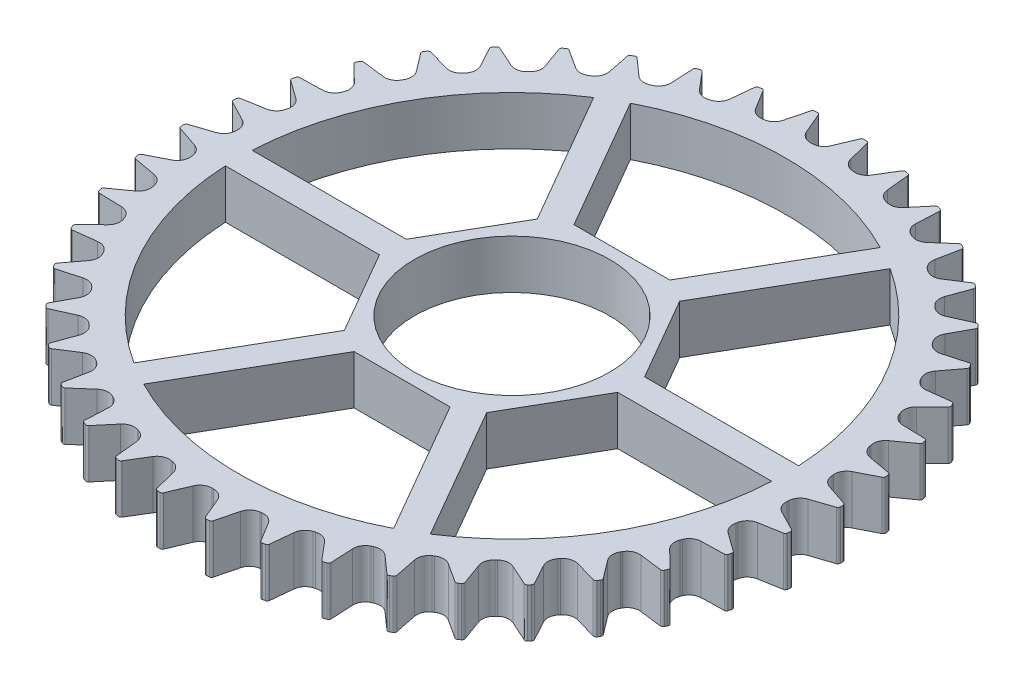
from build123d import *

# Parameters (mm, degrees)
SKETCH_1_R      = 4
EXTRUDE_1_DEPTH = 2


with BuildPart() as part:
    # 草图1 → 凸台-拉伸1 (new body)
    with BuildSketch(Plane(origin=(0, 0, 0), x_dir=(1, 0, 0), z_dir=(0, 1, 0))):
        with BuildLine():
            Line((12.557441002, 0.442284614), (13.431815796, 0.147771369))
            ThreePointArc((13.431815796, 0.147771369), (13.480995582, 0.111506892), (13.499894393, 0.053398385))
            ThreePointArc((13.499894393, 0.053398385), (13.5, 0), (13.499894393, -0.053398385))
            ThreePointArc((13.499894393, -0.053398385), (13.480995582, -0.111506892), (13.431815796, -0.147771369))
            Line((13.431815796, -0.147771369), (12.557441002, -0.442284614))
            ThreePointArc((12.557441002, -0.442284614), (12.321714026, -0.609999625), (12.218336496, -0.880200696))
            ThreePointArc((12.218336496, -0.880200696), (12.215746515, -0.915443646), (12.213054879, -0.950678979))
            ThreePointArc((12.213054879, -0.950678979), (12.275006387, -1.233269748), (12.483103862, -1.434244804))
            Line((12.483103862, -1.434244804), (13.303817691, -1.85578738))
            ThreePointArc((13.303817691, -1.85578738), (13.34704324, -1.89897668), (13.357070343, -1.959252884))
            ThreePointArc((13.357070343, -1.959252884), (13.349216154, -2.012070593), (13.34115311, -2.064856822))
            ThreePointArc((13.34115311, -2.064856822), (13.31380476, -2.119499584), (13.259769332, -2.148029151))
            Line((13.259769332, -2.148029151), (12.35126566, -2.308934125))
            ThreePointArc((12.35126566, -2.308934125), (12.093174934, -2.439642615), (11.950680666, -2.691418142))
            ThreePointArc((11.950680666, -2.691418142), (11.942866924, -2.725881441), (11.934953797, -2.760322056))
            ThreePointArc((11.934953797, -2.760322056), (11.954095389, -3.048989913), (12.12991481, -3.278735563))
            Line((12.12991481, -3.278735563), (12.878634283, -3.817890906))
            ThreePointArc((12.878634283, -3.817890906), (12.914940007, -3.86704025), (12.915871413, -3.928137682))
            ThreePointArc((12.915871413, -3.928137682), (12.900232878, -3.979194855), (12.884392512, -4.030189771))
            ThreePointArc((12.884392512, -4.030189771), (12.84920554, -4.080146158), (12.791521531, -4.10030351))
            Line((12.791521531, -4.10030351), (11.869183453, -4.124005862))
            ThreePointArc((11.869183453, -4.124005862), (11.594494298, -4.21478802), (11.416066378, -4.442513754))
            ThreePointArc((11.416066378, -4.442513754), (11.403203421, -4.475427548), (11.39024557, -4.5083041))
            ThreePointArc((11.39024557, -4.5083041), (11.366149655, -4.796600682), (11.505763505, -5.049984787))
            Line((11.505763505, -5.049984787), (12.165763466, -5.694709057))
            ThreePointArc((12.165763466, -5.694709057), (12.194338355, -5.748720532), (12.186153259, -5.809274374))
            ThreePointArc((12.186153259, -5.809274374), (12.163079717, -5.857430478), (12.139815877, -5.905494939))
            ThreePointArc((12.139815877, -5.905494939), (12.0975763, -5.949649009), (12.037532278, -5.960983864))
            Line((12.037532278, -5.960983864), (11.121963301, -5.846954124))
            ThreePointArc((11.121963301, -5.846954124), (10.836811818, -5.895782026), (10.626436031, -6.094370949))
            ThreePointArc((10.626436031, -6.094370949), (10.608811196, -6.125), (10.591098078, -6.15557808))
            ThreePointArc((10.591098078, -6.15557808), (10.524302918, -6.437063318), (10.624592456, -6.708425697))
            Line((10.624592456, -6.708425697), (11.181129597, -7.444316819))
            ThreePointArc((11.181129597, -7.444316819), (11.201335335, -7.501983896), (11.184216578, -7.560641477))
            ThreePointArc((11.184216578, -7.560641477), (11.154223453, -7.604820784), (11.124055815, -7.648881109))
            ThreePointArc((11.124055815, -7.648881109), (11.075707197, -7.686246532), (11.014644444, -7.688505689))
            Line((11.014644444, -7.688505689), (10.126296867, -7.439291092))
            ThreePointArc((10.126296867, -7.439291092), (9.83705287, -7.445074003), (9.599428664, -7.610089969))
            ThreePointArc((9.599428664, -7.610089969), (9.57743566, -7.637750073), (9.555362956, -7.665346618))
            ThreePointArc((9.555362956, -7.665346618), (9.447360646, -7.933732596), (9.506085569, -8.217011461))
            Line((9.506085569, -8.217011461), (9.946727768, -9.027630844))
            ThreePointArc((9.946727768, -9.027630844), (9.958112994, -9.087665337), (9.93244298, -9.143116343))
            ThreePointArc((9.93244298, -9.143116343), (9.89620027, -9.18233196), (9.859802728, -9.221403915))
            ThreePointArc((9.859802728, -9.221403915), (9.806425097, -9.251146009), (9.745707655, -9.244279002))
            Line((9.745707655, -9.244279002), (8.904425695, -8.86544659))
            ThreePointArc((8.904425695, -8.86544659), (8.617550415, -8.82805533), (8.357985922, -8.955812153))
            ThreePointArc((8.357985922, -8.955812153), (8.332116038, -8.97988543), (8.306176816, -9.003883979))
            ThreePointArc((8.306176816, -9.003883979), (8.159379948, -9.253175398), (8.175228438, -9.542042768))
            Line((8.175228438, -9.542042768), (8.490132478, -10.409282514))
            ThreePointArc((8.490132478, -10.409282514), (8.492442863, -10.470343351), (8.458795018, -10.521349098))
            ThreePointArc((8.458795018, -10.521349098), (8.417112325, -10.554725013), (8.375297942, -10.587935795))
            ThreePointArc((8.375297942, -10.587935795), (8.318083666, -10.609390171), (8.259067861, -10.593550398))
            Line((8.259067861, -10.593550398), (7.483644366, -10.093562661))
            ThreePointArc((7.483644366, -10.093562661), (7.205546125, -10.013832489), (6.929839586, -10.101476294))
            ThreePointArc((6.929839586, -10.101476294), (6.900670711, -10.121424985), (6.871444411, -10.14128945))
            ThreePointArc((6.871444411, -10.14128945), (6.689132185, -10.365917552), (6.661750212, -10.653920607))
            Line((6.661750212, -10.653920607), (6.843881658, -11.558408014))
            ThreePointArc((6.843881658, -11.558408014), (6.837065592, -11.619131196), (6.796191554, -11.6645523))
            ThreePointArc((6.796191554, -11.6645523), (6.75, -11.691342951), (6.703702838, -11.717950685))
            ThreePointArc((6.703702838, -11.717950685), (6.64392999, -11.730638088), (6.587934138, -11.706179383))
            Line((6.587934138, -11.706179383), (5.895690789, -11.096205221))
            ThreePointArc((5.895690789, -11.096205221), (5.632581841, -10.975917177), (5.346892085, -11.021490146))
            ThreePointArc((5.346892085, -11.021490146), (5.315075804, -11.036868632), (5.283215293, -11.052155272))
            ThreePointArc((5.283215293, -11.052155272), (5.069460262, -11.247102237), (4.999459496, -11.527807465))
            Line((4.999459496, -11.527807465), (5.044749831, -12.449337778))
            ThreePointArc((5.044749831, -12.449337778), (5.028959574, -12.508366851), (4.981772401, -12.547188679))
            ThreePointArc((4.981772401, -12.547188679), (4.932103829, -12.566795607), (4.882358092, -12.58620592))
            ThreePointArc((4.882358092, -12.58620592), (4.821361897, -12.589842935), (4.769636853, -12.557311665))
            Line((4.769636853, -12.557311665), (4.176037222, -11.850976893))
            ThreePointArc((4.176037222, -11.850976893), (3.933794986, -11.692818013), (3.64450385, -11.69530212))
            ThreePointArc((3.64450385, -11.69530212), (3.610750887, -11.705766871), (3.576967875, -11.71613421))
            ThreePointArc((3.576967875, -11.71613421), (3.336544974, -11.877045243), (3.225489115, -12.144182153))
            Line((3.225489115, -12.144182153), (3.132926628, -13.062169908))
            ThreePointArc((3.132926628, -13.062169908), (3.108514909, -13.118186259), (3.056068684, -13.149541596))
            ThreePointArc((3.056068684, -13.149541596), (3.004032608, -13.161526814), (2.951949533, -13.173306113))
            ThreePointArc((2.951949533, -13.173306113), (2.891092546, -13.167811495), (2.844793763, -13.127934354))
            Line((2.844793763, -13.127934354), (2.363097884, -12.341017323))
            ThreePointArc((2.363097884, -12.341017323), (2.147133652, -12.148520616), (1.860703422, -12.107860372))
            ThreePointArc((1.860703422, -12.107860372), (1.825767761, -12.113177621), (1.790816906, -12.118394069))
            ThreePointArc((1.790816906, -12.118394069), (1.529096785, -12.241674685), (1.379466638, -12.489275879))
            Line((1.379466638, -12.489275879), (1.151119022, -13.383214747))
            ThreePointArc((1.151119022, -13.383214747), (1.118631158, -13.434967064), (1.062097444, -13.458155484))
            ThreePointArc((1.062097444, -13.458155484), (1.008856263, -13.462251262), (0.955599299, -13.466136416))
            ThreePointArc((0.955599299, -13.466136416), (0.896240965, -13.451632905), (0.856402681, -13.405300683))
            Line((0.856402681, -13.405300683), (0.497370845, -12.55537982))
            ThreePointArc((0.497370845, -12.55537982), (0.3125089, -12.332845343), (0.035337953, -12.24994903))
            ThreePointArc((0.035337953, -12.24994903), (0, -12.25), (-0.035337953, -12.24994903))
            ThreePointArc((-0.035337953, -12.24994903), (-0.3125089, -12.332845343), (-0.497370845, -12.55537982))
            Line((-0.497370845, -12.55537982), (-0.856402681, -13.405300683))
            ThreePointArc((-0.856402681, -13.405300683), (-0.896240965, -13.451632905), (-0.955599299, -13.466136416))
            ThreePointArc((-0.955599299, -13.466136416), (-1.008856263, -13.462251262), (-1.062097444, -13.458155484))
            ThreePointArc((-1.062097444, -13.458155484), (-1.118631158, -13.434967064), (-1.151119022, -13.383214747))
            Line((-1.151119022, -13.383214747), (-1.379466638, -12.489275879))
            ThreePointArc((-1.379466638, -12.489275879), (-1.529096785, -12.241674685), (-1.790816906, -12.118394069))
            ThreePointArc((-1.790816906, -12.118394069), (-1.825767761, -12.113177621), (-1.860703422, -12.107860372))
            ThreePointArc((-1.860703422, -12.107860372), (-2.147133652, -12.148520616), (-2.363097884, -12.341017323))
            Line((-2.363097884, -12.341017323), (-2.844793763, -13.127934354))
            ThreePointArc((-2.844793763, -13.127934354), (-2.891092546, -13.167811495), (-2.951949533, -13.173306113))
            ThreePointArc((-2.951949533, -13.173306113), (-3.004032608, -13.161526814), (-3.056068684, -13.149541596))
            ThreePointArc((-3.056068684, -13.149541596), (-3.108514909, -13.118186259), (-3.132926628, -13.062169908))
            Line((-3.132926628, -13.062169908), (-3.225489115, -12.144182153))
            ThreePointArc((-3.225489115, -12.144182153), (-3.336544974, -11.877045243), (-3.576967875, -11.71613421))
            ThreePointArc((-3.576967875, -11.71613421), (-3.610750887, -11.705766871), (-3.64450385, -11.69530212))
            ThreePointArc((-3.64450385, -11.69530212), (-3.933794986, -11.692818013), (-4.176037222, -11.850976893))
            Line((-4.176037222, -11.850976893), (-4.769636853, -12.557311665))
            ThreePointArc((-4.769636853, -12.557311665), (-4.821361897, -12.589842935), (-4.882358092, -12.58620592))
            ThreePointArc((-4.882358092, -12.58620592), (-4.932103829, -12.566795607), (-4.981772401, -12.547188679))
            ThreePointArc((-4.981772401, -12.547188679), (-5.028959574, -12.508366851), (-5.044749831, -12.449337778))
            Line((-5.044749831, -12.449337778), (-4.999459496, -11.527807465))
            ThreePointArc((-4.999459496, -11.527807465), (-5.069460262, -11.247102237), (-5.283215293, -11.052155272))
            ThreePointArc((-5.283215293, -11.052155272), (-5.315075804, -11.036868632), (-5.346892085, -11.021490146))
            ThreePointArc((-5.346892085, -11.021490146), (-5.632581841, -10.975917177), (-5.895690789, -11.096205221))
            Line((-5.895690789, -11.096205221), (-6.587934138, -11.706179383))
            ThreePointArc((-6.587934138, -11.706179383), (-6.64392999, -11.730638088), (-6.703702838, -11.717950685))
            ThreePointArc((-6.703702838, -11.717950685), (-6.75, -11.691342951), (-6.796191554, -11.6645523))
            ThreePointArc((-6.796191554, -11.6645523), (-6.837065592, -11.619131196), (-6.843881658, -11.558408014))
            Line((-6.843881658, -11.558408014), (-6.661750212, -10.653920607))
            ThreePointArc((-6.661750212, -10.653920607), (-6.689132185, -10.365917552), (-6.871444411, -10.14128945))
            ThreePointArc((-6.871444411, -10.14128945), (-6.900670711, -10.121424985), (-6.929839586, -10.101476294))
            ThreePointArc((-6.929839586, -10.101476294), (-7.205546125, -10.013832489), (-7.483644366, -10.093562661))
            Line((-7.483644366, -10.093562661), (-8.259067861, -10.593550398))
            ThreePointArc((-8.259067861, -10.593550398), (-8.318083666, -10.609390171), (-8.375297942, -10.587935795))
            ThreePointArc((-8.375297942, -10.587935795), (-8.417112325, -10.554725013), (-8.458795018, -10.521349098))
            ThreePointArc((-8.458795018, -10.521349098), (-8.492442863, -10.470343351), (-8.490132478, -10.409282514))
            Line((-8.490132478, -10.409282514), (-8.175228438, -9.542042768))
            ThreePointArc((-8.175228438, -9.542042768), (-8.159379948, -9.253175398), (-8.306176816, -9.003883979))
            ThreePointArc((-8.306176816, -9.003883979), (-8.332116038, -8.97988543), (-8.357985922, -8.955812153))
            ThreePointArc((-8.357985922, -8.955812153), (-8.617550415, -8.82805533), (-8.904425695, -8.86544659))
            Line((-8.904425695, -8.86544659), (-9.745707655, -9.244279002))
            ThreePointArc((-9.745707655, -9.244279002), (-9.806425097, -9.251146009), (-9.859802728, -9.221403915))
            ThreePointArc((-9.859802728, -9.221403915), (-9.89620027, -9.18233196), (-9.93244298, -9.143116343))
            ThreePointArc((-9.93244298, -9.143116343), (-9.958112994, -9.087665337), (-9.946727768, -9.027630844))
            Line((-9.946727768, -9.027630844), (-9.506085569, -8.217011461))
            ThreePointArc((-9.506085569, -8.217011461), (-9.447360646, -7.933732596), (-9.555362956, -7.665346618))
            ThreePointArc((-9.555362956, -7.665346618), (-9.57743566, -7.637750073), (-9.599428664, -7.610089969))
            ThreePointArc((-9.599428664, -7.610089969), (-9.83705287, -7.445074003), (-10.126296867, -7.439291092))
            Line((-10.126296867, -7.439291092), (-11.014644444, -7.688505689))
            ThreePointArc((-11.014644444, -7.688505689), (-11.075707197, -7.686246532), (-11.124055815, -7.648881109))
            ThreePointArc((-11.124055815, -7.648881109), (-11.154223453, -7.604820784), (-11.184216578, -7.560641477))
            ThreePointArc((-11.184216578, -7.560641477), (-11.201335335, -7.501983896), (-11.181129597, -7.444316819))
            Line((-11.181129597, -7.444316819), (-10.624592456, -6.708425697))
            ThreePointArc((-10.624592456, -6.708425697), (-10.524302918, -6.437063318), (-10.591098078, -6.15557808))
            ThreePointArc((-10.591098078, -6.15557808), (-10.608811196, -6.125), (-10.626436031, -6.094370949))
            ThreePointArc((-10.626436031, -6.094370949), (-10.836811818, -5.895782026), (-11.121963301, -5.846954124))
            Line((-11.121963301, -5.846954124), (-12.037532278, -5.960983864))
            ThreePointArc((-12.037532278, -5.960983864), (-12.0975763, -5.949649009), (-12.139815877, -5.905494939))
            ThreePointArc((-12.139815877, -5.905494939), (-12.163079717, -5.857430478), (-12.186153259, -5.809274374))
            ThreePointArc((-12.186153259, -5.809274374), (-12.194338355, -5.748720532), (-12.165763466, -5.694709057))
            Line((-12.165763466, -5.694709057), (-11.505763505, -5.049984787))
            ThreePointArc((-11.505763505, -5.049984787), (-11.366149655, -4.796600682), (-11.39024557, -4.5083041))
            ThreePointArc((-11.39024557, -4.5083041), (-11.403203421, -4.475427548), (-11.416066378, -4.442513754))
            ThreePointArc((-11.416066378, -4.442513754), (-11.594494298, -4.21478802), (-11.869183453, -4.124005862))
            Line((-11.869183453, -4.124005862), (-12.791521531, -4.10030351))
            ThreePointArc((-12.791521531, -4.10030351), (-12.84920554, -4.080146158), (-12.884392512, -4.030189771))
            ThreePointArc((-12.884392512, -4.030189771), (-12.900232878, -3.979194855), (-12.915871413, -3.928137682))
            ThreePointArc((-12.915871413, -3.928137682), (-12.914940007, -3.86704025), (-12.878634283, -3.817890906))
            Line((-12.878634283, -3.817890906), (-12.12991481, -3.278735563))
            ThreePointArc((-12.12991481, -3.278735563), (-11.954095389, -3.048989913), (-11.934953797, -2.760322056))
            ThreePointArc((-11.934953797, -2.760322056), (-11.942866924, -2.725881441), (-11.950680666, -2.691418142))
            ThreePointArc((-11.950680666, -2.691418142), (-12.093174934, -2.439642615), (-12.35126566, -2.308934125))
            Line((-12.35126566, -2.308934125), (-13.259769332, -2.148029151))
            ThreePointArc((-13.259769332, -2.148029151), (-13.31380476, -2.119499584), (-13.34115311, -2.064856822))
            ThreePointArc((-13.34115311, -2.064856822), (-13.349216154, -2.012070593), (-13.357070343, -1.959252884))
            ThreePointArc((-13.357070343, -1.959252884), (-13.34704324, -1.89897668), (-13.303817691, -1.85578738))
            Line((-13.303817691, -1.85578738), (-12.483103862, -1.434244804))
            ThreePointArc((-12.483103862, -1.434244804), (-12.275006387, -1.233269748), (-12.213054879, -0.950678979))
            ThreePointArc((-12.213054879, -0.950678979), (-12.215746515, -0.915443646), (-12.218336496, -0.880200696))
            ThreePointArc((-12.218336496, -0.880200696), (-12.321714026, -0.609999625), (-12.557441002, -0.442284614))
            Line((-12.557441002, -0.442284614), (-13.431815796, -0.147771369))
            ThreePointArc((-13.431815796, -0.147771369), (-13.480995582, -0.111506892), (-13.499894393, -0.053398385))
            ThreePointArc((-13.499894393, -0.053398385), (-13.5, 0), (-13.499894393, 0.053398385))
            ThreePointArc((-13.499894393, 0.053398385), (-13.480995582, 0.111506892), (-13.431815796, 0.147771369))
            Line((-13.431815796, 0.147771369), (-12.557441002, 0.442284614))
            ThreePointArc((-12.557441002, 0.442284614), (-12.321714026, 0.609999625), (-12.218336496, 0.880200696))
            ThreePointArc((-12.218336496, 0.880200696), (-12.215746515, 0.915443646), (-12.213054879, 0.950678979))
            ThreePointArc((-12.213054879, 0.950678979), (-12.275006387, 1.233269748), (-12.483103862, 1.434244804))
            Line((-12.483103862, 1.434244804), (-13.303817691, 1.85578738))
            ThreePointArc((-13.303817691, 1.85578738), (-13.34704324, 1.89897668), (-13.357070343, 1.959252884))
            ThreePointArc((-13.357070343, 1.959252884), (-13.349216154, 2.012070593), (-13.34115311, 2.064856822))
            ThreePointArc((-13.34115311, 2.064856822), (-13.31380476, 2.119499584), (-13.259769332, 2.148029151))
            Line((-13.259769332, 2.148029151), (-12.35126566, 2.308934125))
            ThreePointArc((-12.35126566, 2.308934125), (-12.093174934, 2.439642615), (-11.950680666, 2.691418142))
            ThreePointArc((-11.950680666, 2.691418142), (-11.942866924, 2.725881441), (-11.934953797, 2.760322056))
            ThreePointArc((-11.934953797, 2.760322056), (-11.954095389, 3.048989913), (-12.12991481, 3.278735563))
            Line((-12.12991481, 3.278735563), (-12.878634283, 3.817890906))
            ThreePointArc((-12.878634283, 3.817890906), (-12.914940007, 3.86704025), (-12.915871413, 3.928137682))
            ThreePointArc((-12.915871413, 3.928137682), (-12.900232878, 3.979194855), (-12.884392512, 4.030189771))
            ThreePointArc((-12.884392512, 4.030189771), (-12.84920554, 4.080146158), (-12.791521531, 4.10030351))
            Line((-12.791521531, 4.10030351), (-11.869183453, 4.124005862))
            ThreePointArc((-11.869183453, 4.124005862), (-11.594494298, 4.21478802), (-11.416066378, 4.442513754))
            ThreePointArc((-11.416066378, 4.442513754), (-11.403203421, 4.475427548), (-11.39024557, 4.5083041))
            ThreePointArc((-11.39024557, 4.5083041), (-11.366149655, 4.796600682), (-11.505763505, 5.049984787))
            Line((-11.505763505, 5.049984787), (-12.165763466, 5.694709057))
            ThreePointArc((-12.165763466, 5.694709057), (-12.194338355, 5.748720532), (-12.186153259, 5.809274374))
            ThreePointArc((-12.186153259, 5.809274374), (-12.163079717, 5.857430478), (-12.139815877, 5.905494939))
            ThreePointArc((-12.139815877, 5.905494939), (-12.0975763, 5.949649009), (-12.037532278, 5.960983864))
            Line((-12.037532278, 5.960983864), (-11.121963301, 5.846954124))
            ThreePointArc((-11.121963301, 5.846954124), (-10.836811818, 5.895782026), (-10.626436031, 6.094370949))
            ThreePointArc((-10.626436031, 6.094370949), (-10.608811196, 6.125), (-10.591098078, 6.15557808))
            ThreePointArc((-10.591098078, 6.15557808), (-10.524302918, 6.437063318), (-10.624592456, 6.708425697))
            Line((-10.624592456, 6.708425697), (-11.181129597, 7.444316819))
            ThreePointArc((-11.181129597, 7.444316819), (-11.201335335, 7.501983896), (-11.184216578, 7.560641477))
            ThreePointArc((-11.184216578, 7.560641477), (-11.154223453, 7.604820784), (-11.124055815, 7.648881109))
            ThreePointArc((-11.124055815, 7.648881109), (-11.075707197, 7.686246532), (-11.014644444, 7.688505689))
            Line((-11.014644444, 7.688505689), (-10.126296867, 7.439291092))
            ThreePointArc((-10.126296867, 7.439291092), (-9.83705287, 7.445074003), (-9.599428664, 7.610089969))
            ThreePointArc((-9.599428664, 7.610089969), (-9.57743566, 7.637750073), (-9.555362956, 7.665346618))
            ThreePointArc((-9.555362956, 7.665346618), (-9.447360646, 7.933732596), (-9.506085569, 8.217011461))
            Line((-9.506085569, 8.217011461), (-9.946727768, 9.027630844))
            ThreePointArc((-9.946727768, 9.027630844), (-9.958112994, 9.087665337), (-9.93244298, 9.143116343))
            ThreePointArc((-9.93244298, 9.143116343), (-9.89620027, 9.18233196), (-9.859802728, 9.221403915))
            ThreePointArc((-9.859802728, 9.221403915), (-9.806425097, 9.251146009), (-9.745707655, 9.244279002))
            Line((-9.745707655, 9.244279002), (-8.904425695, 8.86544659))
            ThreePointArc((-8.904425695, 8.86544659), (-8.617550415, 8.82805533), (-8.357985922, 8.955812153))
            ThreePointArc((-8.357985922, 8.955812153), (-8.332116038, 8.97988543), (-8.306176816, 9.003883979))
            ThreePointArc((-8.306176816, 9.003883979), (-8.159379948, 9.253175398), (-8.175228438, 9.542042768))
            Line((-8.175228438, 9.542042768), (-8.490132478, 10.409282514))
            ThreePointArc((-8.490132478, 10.409282514), (-8.492442863, 10.470343351), (-8.458795018, 10.521349098))
            ThreePointArc((-8.458795018, 10.521349098), (-8.417112325, 10.554725013), (-8.375297942, 10.587935795))
            ThreePointArc((-8.375297942, 10.587935795), (-8.318083666, 10.609390171), (-8.259067861, 10.593550398))
            Line((-8.259067861, 10.593550398), (-7.483644366, 10.093562661))
            ThreePointArc((-7.483644366, 10.093562661), (-7.205546125, 10.013832489), (-6.929839586, 10.101476294))
            ThreePointArc((-6.929839586, 10.101476294), (-6.900670711, 10.121424985), (-6.871444411, 10.14128945))
            ThreePointArc((-6.871444411, 10.14128945), (-6.689132185, 10.365917552), (-6.661750212, 10.653920607))
            Line((-6.661750212, 10.653920607), (-6.843881658, 11.558408014))
            ThreePointArc((-6.843881658, 11.558408014), (-6.837065592, 11.619131196), (-6.796191554, 11.6645523))
            ThreePointArc((-6.796191554, 11.6645523), (-6.75, 11.691342951), (-6.703702838, 11.717950685))
            ThreePointArc((-6.703702838, 11.717950685), (-6.64392999, 11.730638088), (-6.587934138, 11.706179383))
            Line((-6.587934138, 11.706179383), (-5.895690789, 11.096205221))
            ThreePointArc((-5.895690789, 11.096205221), (-5.632581841, 10.975917177), (-5.346892085, 11.021490146))
            ThreePointArc((-5.346892085, 11.021490146), (-5.315075804, 11.036868632), (-5.283215293, 11.052155272))
            ThreePointArc((-5.283215293, 11.052155272), (-5.069460262, 11.247102237), (-4.999459496, 11.527807465))
            Line((-4.999459496, 11.527807465), (-5.044749831, 12.449337778))
            ThreePointArc((-5.044749831, 12.449337778), (-5.028959574, 12.508366851), (-4.981772401, 12.547188679))
            ThreePointArc((-4.981772401, 12.547188679), (-4.932103829, 12.566795607), (-4.882358092, 12.58620592))
            ThreePointArc((-4.882358092, 12.58620592), (-4.821361897, 12.589842935), (-4.769636853, 12.557311665))
            Line((-4.769636853, 12.557311665), (-4.176037222, 11.850976893))
            ThreePointArc((-4.176037222, 11.850976893), (-3.933794986, 11.692818013), (-3.64450385, 11.69530212))
            ThreePointArc((-3.64450385, 11.69530212), (-3.610750887, 11.705766871), (-3.576967875, 11.71613421))
            ThreePointArc((-3.576967875, 11.71613421), (-3.336544974, 11.877045243), (-3.225489115, 12.144182153))
            Line((-3.225489115, 12.144182153), (-3.132926628, 13.062169908))
            ThreePointArc((-3.132926628, 13.062169908), (-3.108514909, 13.118186259), (-3.056068684, 13.149541596))
            ThreePointArc((-3.056068684, 13.149541596), (-3.004032608, 13.161526814), (-2.951949533, 13.173306113))
            ThreePointArc((-2.951949533, 13.173306113), (-2.891092546, 13.167811495), (-2.844793763, 13.127934354))
            Line((-2.844793763, 13.127934354), (-2.363097884, 12.341017323))
            ThreePointArc((-2.363097884, 12.341017323), (-2.147133652, 12.148520616), (-1.860703422, 12.107860372))
            ThreePointArc((-1.860703422, 12.107860372), (-1.825767761, 12.113177621), (-1.790816906, 12.118394069))
            ThreePointArc((-1.790816906, 12.118394069), (-1.529096785, 12.241674685), (-1.379466638, 12.489275879))
            Line((-1.379466638, 12.489275879), (-1.151119022, 13.383214747))
            ThreePointArc((-1.151119022, 13.383214747), (-1.118631158, 13.434967064), (-1.062097444, 13.458155484))
            ThreePointArc((-1.062097444, 13.458155484), (-1.008856263, 13.462251262), (-0.955599299, 13.466136416))
            ThreePointArc((-0.955599299, 13.466136416), (-0.896240965, 13.451632905), (-0.856402681, 13.405300683))
            Line((-0.856402681, 13.405300683), (-0.497370845, 12.55537982))
            ThreePointArc((-0.497370845, 12.55537982), (-0.3125089, 12.332845343), (-0.035337953, 12.24994903))
            ThreePointArc((-0.035337953, 12.24994903), (0, 12.25), (0.035337953, 12.24994903))
            ThreePointArc((0.035337953, 12.24994903), (0.3125089, 12.332845343), (0.497370845, 12.55537982))
            Line((0.497370845, 12.55537982), (0.856402681, 13.405300683))
            ThreePointArc((0.856402681, 13.405300683), (0.896240965, 13.451632905), (0.955599299, 13.466136416))
            ThreePointArc((0.955599299, 13.466136416), (1.008856263, 13.462251262), (1.062097444, 13.458155484))
            ThreePointArc((1.062097444, 13.458155484), (1.118631158, 13.434967064), (1.151119022, 13.383214747))
            Line((1.151119022, 13.383214747), (1.379466638, 12.489275879))
            ThreePointArc((1.379466638, 12.489275879), (1.529096785, 12.241674685), (1.790816906, 12.118394069))
            ThreePointArc((1.790816906, 12.118394069), (1.825767761, 12.113177621), (1.860703422, 12.107860372))
            ThreePointArc((1.860703422, 12.107860372), (2.147133652, 12.148520616), (2.363097884, 12.341017323))
            Line((2.363097884, 12.341017323), (2.844793763, 13.127934354))
            ThreePointArc((2.844793763, 13.127934354), (2.891092546, 13.167811495), (2.951949533, 13.173306113))
            ThreePointArc((2.951949533, 13.173306113), (3.004032608, 13.161526814), (3.056068684, 13.149541596))
            ThreePointArc((3.056068684, 13.149541596), (3.108514909, 13.118186259), (3.132926628, 13.062169908))
            Line((3.132926628, 13.062169908), (3.225489115, 12.144182153))
            ThreePointArc((3.225489115, 12.144182153), (3.336544974, 11.877045243), (3.576967875, 11.71613421))
            ThreePointArc((3.576967875, 11.71613421), (3.610750887, 11.705766871), (3.64450385, 11.69530212))
            ThreePointArc((3.64450385, 11.69530212), (3.933794986, 11.692818013), (4.176037222, 11.850976893))
            Line((4.176037222, 11.850976893), (4.769636853, 12.557311665))
            ThreePointArc((4.769636853, 12.557311665), (4.821361897, 12.589842935), (4.882358092, 12.58620592))
            ThreePointArc((4.882358092, 12.58620592), (4.932103829, 12.566795607), (4.981772401, 12.547188679))
            ThreePointArc((4.981772401, 12.547188679), (5.028959574, 12.508366851), (5.044749831, 12.449337778))
            Line((5.044749831, 12.449337778), (4.999459496, 11.527807465))
            ThreePointArc((4.999459496, 11.527807465), (5.069460262, 11.247102237), (5.283215293, 11.052155272))
            ThreePointArc((5.283215293, 11.052155272), (5.315075804, 11.036868632), (5.346892085, 11.021490146))
            ThreePointArc((5.346892085, 11.021490146), (5.632581841, 10.975917177), (5.895690789, 11.096205221))
            Line((5.895690789, 11.096205221), (6.587934138, 11.706179383))
            ThreePointArc((6.587934138, 11.706179383), (6.64392999, 11.730638088), (6.703702838, 11.717950685))
            ThreePointArc((6.703702838, 11.717950685), (6.75, 11.691342951), (6.796191554, 11.6645523))
            ThreePointArc((6.796191554, 11.6645523), (6.837065592, 11.619131196), (6.843881658, 11.558408014))
            Line((6.843881658, 11.558408014), (6.661750212, 10.653920607))
            ThreePointArc((6.661750212, 10.653920607), (6.689132185, 10.365917552), (6.871444411, 10.14128945))
            ThreePointArc((6.871444411, 10.14128945), (6.900670711, 10.121424985), (6.929839586, 10.101476294))
            ThreePointArc((6.929839586, 10.101476294), (7.205546125, 10.013832489), (7.483644366, 10.093562661))
            Line((7.483644366, 10.093562661), (8.259067861, 10.593550398))
            ThreePointArc((8.259067861, 10.593550398), (8.318083666, 10.609390171), (8.375297942, 10.587935795))
            ThreePointArc((8.375297942, 10.587935795), (8.417112325, 10.554725013), (8.458795018, 10.521349098))
            ThreePointArc((8.458795018, 10.521349098), (8.492442863, 10.470343351), (8.490132478, 10.409282514))
            Line((8.490132478, 10.409282514), (8.175228438, 9.542042768))
            ThreePointArc((8.175228438, 9.542042768), (8.159379948, 9.253175398), (8.306176816, 9.003883979))
            ThreePointArc((8.306176816, 9.003883979), (8.332116038, 8.97988543), (8.357985922, 8.955812153))
            ThreePointArc((8.357985922, 8.955812153), (8.617550415, 8.82805533), (8.904425695, 8.86544659))
            Line((8.904425695, 8.86544659), (9.745707655, 9.244279002))
            ThreePointArc((9.745707655, 9.244279002), (9.806425097, 9.251146009), (9.859802728, 9.221403915))
            ThreePointArc((9.859802728, 9.221403915), (9.89620027, 9.18233196), (9.93244298, 9.143116343))
            ThreePointArc((9.93244298, 9.143116343), (9.958112994, 9.087665337), (9.946727768, 9.027630844))
            Line((9.946727768, 9.027630844), (9.506085569, 8.217011461))
            ThreePointArc((9.506085569, 8.217011461), (9.447360646, 7.933732596), (9.555362956, 7.665346618))
            ThreePointArc((9.555362956, 7.665346618), (9.57743566, 7.637750073), (9.599428664, 7.610089969))
            ThreePointArc((9.599428664, 7.610089969), (9.83705287, 7.445074003), (10.126296867, 7.439291092))
            Line((10.126296867, 7.439291092), (11.014644444, 7.688505689))
            ThreePointArc((11.014644444, 7.688505689), (11.075707197, 7.686246532), (11.124055815, 7.648881109))
            ThreePointArc((11.124055815, 7.648881109), (11.154223453, 7.604820784), (11.184216578, 7.560641477))
            ThreePointArc((11.184216578, 7.560641477), (11.201335335, 7.501983896), (11.181129597, 7.444316819))
            Line((11.181129597, 7.444316819), (10.624592456, 6.708425697))
            ThreePointArc((10.624592456, 6.708425697), (10.524302918, 6.437063318), (10.591098078, 6.15557808))
            ThreePointArc((10.591098078, 6.15557808), (10.608811196, 6.125), (10.626436031, 6.094370949))
            ThreePointArc((10.626436031, 6.094370949), (10.836811818, 5.895782026), (11.121963301, 5.846954124))
            Line((11.121963301, 5.846954124), (12.037532278, 5.960983864))
            ThreePointArc((12.037532278, 5.960983864), (12.0975763, 5.949649009), (12.139815877, 5.905494939))
            ThreePointArc((12.139815877, 5.905494939), (12.163079717, 5.857430478), (12.186153259, 5.809274374))
            ThreePointArc((12.186153259, 5.809274374), (12.194338355, 5.748720532), (12.165763466, 5.694709057))
            Line((12.165763466, 5.694709057), (11.505763505, 5.049984787))
            ThreePointArc((11.505763505, 5.049984787), (11.366149655, 4.796600682), (11.39024557, 4.5083041))
            ThreePointArc((11.39024557, 4.5083041), (11.403203421, 4.475427548), (11.416066378, 4.442513754))
            ThreePointArc((11.416066378, 4.442513754), (11.594494298, 4.21478802), (11.869183453, 4.124005862))
            Line((11.869183453, 4.124005862), (12.791521531, 4.10030351))
            ThreePointArc((12.791521531, 4.10030351), (12.84920554, 4.080146158), (12.884392512, 4.030189771))
            ThreePointArc((12.884392512, 4.030189771), (12.900232878, 3.979194855), (12.915871413, 3.928137682))
            ThreePointArc((12.915871413, 3.928137682), (12.914940007, 3.86704025), (12.878634283, 3.817890906))
            Line((12.878634283, 3.817890906), (12.12991481, 3.278735563))
            ThreePointArc((12.12991481, 3.278735563), (11.954095389, 3.048989913), (11.934953797, 2.760322056))
            ThreePointArc((11.934953797, 2.760322056), (11.942866924, 2.725881441), (11.950680666, 2.691418142))
            ThreePointArc((11.950680666, 2.691418142), (12.093174934, 2.439642615), (12.35126566, 2.308934125))
            Line((12.35126566, 2.308934125), (13.259769332, 2.148029151))
            ThreePointArc((13.259769332, 2.148029151), (13.31380476, 2.119499584), (13.34115311, 2.064856822))
            ThreePointArc((13.34115311, 2.064856822), (13.349216154, 2.012070593), (13.357070343, 1.959252884))
            ThreePointArc((13.357070343, 1.959252884), (13.34704324, 1.89897668), (13.303817691, 1.85578738))
            Line((13.303817691, 1.85578738), (12.483103862, 1.434244804))
            ThreePointArc((12.483103862, 1.434244804), (12.275006387, 1.233269748), (12.213054879, 0.950678979))
            ThreePointArc((12.213054879, 0.950678979), (12.215746515, 0.915443646), (12.218336496, 0.880200696))
            ThreePointArc((12.218336496, 0.880200696), (12.321714026, 0.609999625), (12.557441002, 0.442284614))
        make_face()
        with Locations(Location((0, 0, 0), (0, 0, 270))):
            Circle(SKETCH_1_R, mode=Mode.SUBTRACT)
        with BuildLine():
            Line((2.915618859, -3.95), (4.878609775, -0.55))
            Line((4.878609775, -0.55), (11.186487384, -0.55))
            ThreePointArc((11.186487384, -0.55), (9.699484522, -5.6), (6.069557664, -9.412782254))
            Line((6.069557664, -9.412782254), (2.915618859, -3.95))
        make_face(mode=Mode.SUBTRACT)
        with BuildLine():
            Line((1.962990915, -4.5), (-1.962990915, -4.5))
            Line((-1.962990915, -4.5), (-5.11692972, -9.962782254))
            ThreePointArc((-5.11692972, -9.962782254), (0, -11.2), (5.11692972, -9.962782254))
            Line((5.11692972, -9.962782254), (1.962990915, -4.5))
        make_face(mode=Mode.SUBTRACT)
        with BuildLine():
            Line((-2.915618859, -3.95), (-4.878609775, -0.55))
            Line((-4.878609775, -0.55), (-11.186487384, -0.55))
            ThreePointArc((-11.186487384, -0.55), (-9.699484522, -5.6), (-6.069557664, -9.412782254))
            Line((-6.069557664, -9.412782254), (-2.915618859, -3.95))
        make_face(mode=Mode.SUBTRACT)
        with BuildLine():
            Line((4.878609775, 0.55), (11.186487384, 0.55))
            ThreePointArc((11.186487384, 0.55), (9.699484522, 5.6), (6.069557664, 9.412782254))
            Line((6.069557664, 9.412782254), (2.915618859, 3.95))
            Line((2.915618859, 3.95), (4.878609775, 0.55))
        make_face(mode=Mode.SUBTRACT)
        with BuildLine():
            Line((-4.878609775, 0.55), (-11.186487384, 0.55))
            ThreePointArc((-11.186487384, 0.55), (-9.699484522, 5.6), (-6.069557664, 9.412782254))
            Line((-6.069557664, 9.412782254), (-2.915618859, 3.95))
            Line((-2.915618859, 3.95), (-4.878609775, 0.55))
        make_face(mode=Mode.SUBTRACT)
        with BuildLine():
            Line((-1.962990915, 4.5), (-5.11692972, 9.962782254))
            ThreePointArc((-5.11692972, 9.962782254), (0, 11.2), (5.11692972, 9.962782254))
            Line((5.11692972, 9.962782254), (1.962990915, 4.5))
            Line((1.962990915, 4.5), (-1.962990915, 4.5))
        make_face(mode=Mode.SUBTRACT)
    extrude(amount=EXTRUDE_1_DEPTH)


solid = part.part
